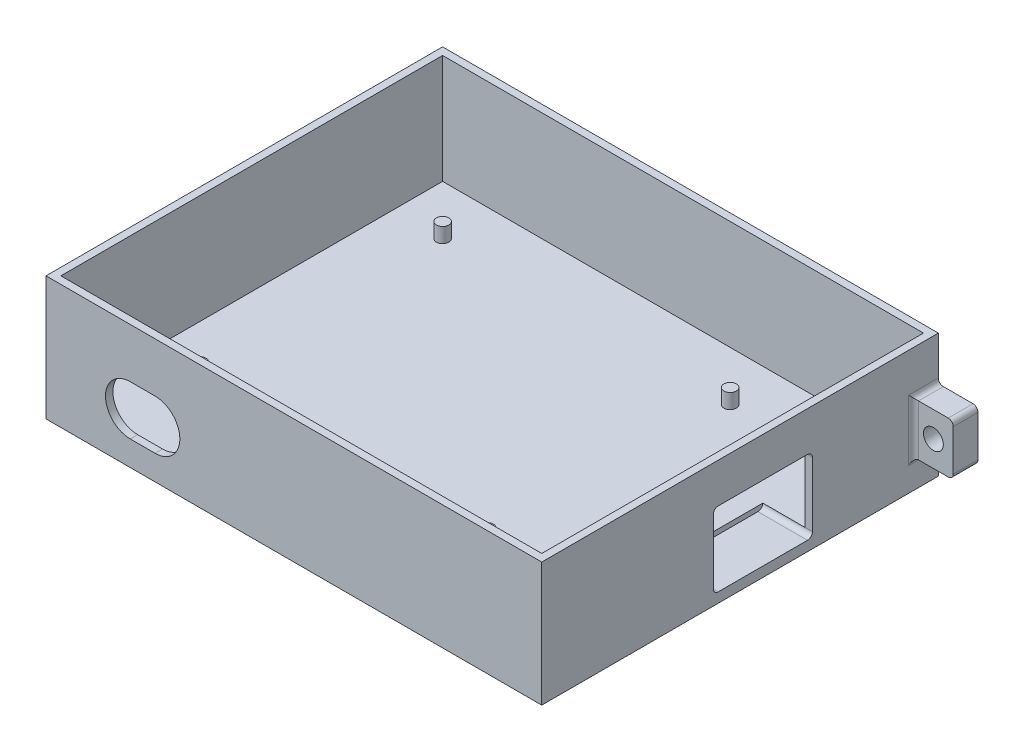
from build123d import *

# Parameters (mm, degrees)
SKETCH1_W           = 100
SKETCH1_H           = 80
BOSS_EXTRUDE1_DEPTH = 3
SKETCH2_W           = 100
SKETCH2_H           = 80
SKETCH2_W_2         = 97
SKETCH2_H_2         = 77
BOSS_EXTRUDE2_DEPTH = 22
SKETCH3_R           = 1.25
BOSS_EXTRUDE3_DEPTH = 3
CUT_EXTRUDE1_DEPTH  = 3
SKETCH5_W           = 8
SKETCH5_H           = 10.304098564
SKETCH5_R           = 2
BOSS_EXTRUDE4_DEPTH = 5
FILLET8_R           = 1
FILLET9_R           = 1
FILLET10_R          = 1
FILLET11_R          = 1
FILLET12_R          = 1
FILLET13_R          = 1
FILLET14_R          = 1
FILLET15_R          = 1
FILLET16_R          = 1
FILLET17_R          = 1
SKETCH6_W           = 20
SKETCH6_H           = 15
CUT_EXTRUDE2_DEPTH  = 10
FILLET18_R          = 1
FILLET19_R          = 1
FILLET20_R          = 1
FILLET22_R          = 1


with BuildPart() as part:
    # Sketch1 → Boss-Extrude1 (new body)
    with BuildSketch(Plane(origin=(0, 0, 0), x_dir=(1, 0, 0), z_dir=(0, 1, 0))):
        Rectangle(SKETCH1_W, SKETCH1_H)
    extrude(amount=BOSS_EXTRUDE1_DEPTH)

    # Sketch2 → Boss-Extrude2 (add)
    with BuildSketch(Plane(origin=(0, 3, 0), x_dir=(1, 0, 0), z_dir=(0, 1, 0))):
        Rectangle(SKETCH2_W, SKETCH2_H)
        Rectangle(SKETCH2_W_2, SKETCH2_H_2, mode=Mode.SUBTRACT)
    extrude(amount=BOSS_EXTRUDE2_DEPTH)

    # Sketch3 → Boss-Extrude3 (add)
    with BuildSketch(Plane(origin=(0, 3, 0), x_dir=(1, 0, 0), z_dir=(0, 1, 0))):
        with Locations(Location((-38.5, 28.5, 0), (0, 0, 90))):
            Circle(SKETCH3_R)
        with Locations(Location((-38.5, -20.5, 0), (0, 0, 90))):
            Circle(SKETCH3_R)
        with Locations(Location((19.5, 28.5, 0), (0, 0, 90))):
            Circle(SKETCH3_R)
        with Locations(Location((19.5, -20.5, 0), (0, 0, 90))):
            Circle(SKETCH3_R)
    extrude(amount=BOSS_EXTRUDE3_DEPTH)

    # Sketch4 → Cut-Extrude1 (cut)
    with BuildSketch(Plane.XY.offset(40)):
        with BuildLine():
            Line((-33, 15), (-28, 15))
            ThreePointArc((-28, 15), (-23, 10), (-28, 5))
            Line((-28, 5), (-33, 5))
            ThreePointArc((-33, 5), (-38, 10), (-33, 15))
        make_face()
    extrude(amount=-CUT_EXTRUDE1_DEPTH, mode=Mode.SUBTRACT)

    # Sketch5 → Boss-Extrude4 (add)
    # profile 1 of 2: a face of its own
    with BuildSketch(Plane(origin=(0, 0, -40), x_dir=(-1, 0, 0), z_dir=(0, 0, -1))):
        with Locations((54, 11)):
            Rectangle(SKETCH5_W, SKETCH5_H)
        with Locations((54, 11)):
            Circle(SKETCH5_R, mode=Mode.SUBTRACT)
    # profile 2 of 2: a face of its own
    with BuildSketch(Plane(origin=(0, 0, -40), x_dir=(-1, 0, 0), z_dir=(0, 0, -1))):
        with Locations((-54, 11)):
            Rectangle(SKETCH5_W, SKETCH5_H)
        with Locations((-54, 11)):
            Circle(SKETCH5_R, mode=Mode.SUBTRACT)
    extrude(amount=-BOSS_EXTRUDE4_DEPTH)

    # Fillet8
    fillet8_edges = [part.edges().sort_by_distance(p)[0] for p in [
        (58, 16.152049282, -37.5),
    ]]
    fillet(fillet8_edges, radius=FILLET8_R)

    # Fillet9
    fillet9_edges = [part.edges().sort_by_distance(p)[0] for p in [
        (58, 5.847950718, -37.5),
    ]]
    fillet(fillet9_edges, radius=FILLET9_R)

    # Fillet10
    fillet10_edges = [part.edges().sort_by_distance(p)[0] for p in [
        (50, 5.847950718, -37.5),
    ]]
    fillet(fillet10_edges, radius=FILLET10_R)

    # Fillet11
    fillet11_edges = [part.edges().sort_by_distance(p)[0] for p in [
        (50, 16.152049282, -37.5),
    ]]
    fillet(fillet11_edges, radius=FILLET11_R)

    # Fillet12
    fillet12_edges = [part.edges().sort_by_distance(p)[0] for p in [
        (50, 11, -35),
    ]]
    fillet(fillet12_edges, radius=FILLET12_R)

    # Fillet13
    fillet13_edges = [part.edges().sort_by_distance(p)[0] for p in [
        (-58, 5.847950718, -37.5),
    ]]
    fillet(fillet13_edges, radius=FILLET13_R)

    # Fillet14
    fillet14_edges = [part.edges().sort_by_distance(p)[0] for p in [
        (-58, 16.152049282, -37.5),
    ]]
    fillet(fillet14_edges, radius=FILLET14_R)

    # Fillet15
    fillet15_edges = [part.edges().sort_by_distance(p)[0] for p in [
        (-50, 5.847950718, -37.5),
    ]]
    fillet(fillet15_edges, radius=FILLET15_R)

    # Fillet16
    fillet16_edges = [part.edges().sort_by_distance(p)[0] for p in [
        (-50, 16.152049282, -37.5),
    ]]
    fillet(fillet16_edges, radius=FILLET16_R)

    # Fillet17
    fillet17_edges = [part.edges().sort_by_distance(p)[0] for p in [
        (-50, 11, -35),
    ]]
    fillet(fillet17_edges, radius=FILLET17_R)

    # Sketch6 → Cut-Extrude2 (cut)
    with BuildSketch(Plane(origin=(50, 0, 0), x_dir=(0, 0, -1), z_dir=(1, 0, 0))):
        with Locations((4.6, 9.5)):
            Rectangle(SKETCH6_W, SKETCH6_H)
    extrude(amount=-CUT_EXTRUDE2_DEPTH, mode=Mode.SUBTRACT)

    # Fillet18
    fillet18_edges = [part.edges().sort_by_distance(p)[0] for p in [
        (45, 2, 5.4),
    ]]
    fillet(fillet18_edges, radius=FILLET18_R)

    # Fillet19
    fillet19_edges = [part.edges().sort_by_distance(p)[0] for p in [
        (45, 2, -14.6),
    ]]
    fillet(fillet19_edges, radius=FILLET19_R)

    # Fillet20
    fillet20_edges = [part.edges().sort_by_distance(p)[0] for p in [
        (49.25, 17, 5.4),
    ]]
    fillet(fillet20_edges, radius=FILLET20_R)

    # Fillet22
    fillet22_edges = [part.edges().sort_by_distance(p)[0] for p in [
        (49.25, 17, -14.6),
    ]]
    fillet(fillet22_edges, radius=FILLET22_R)


solid = part.part
